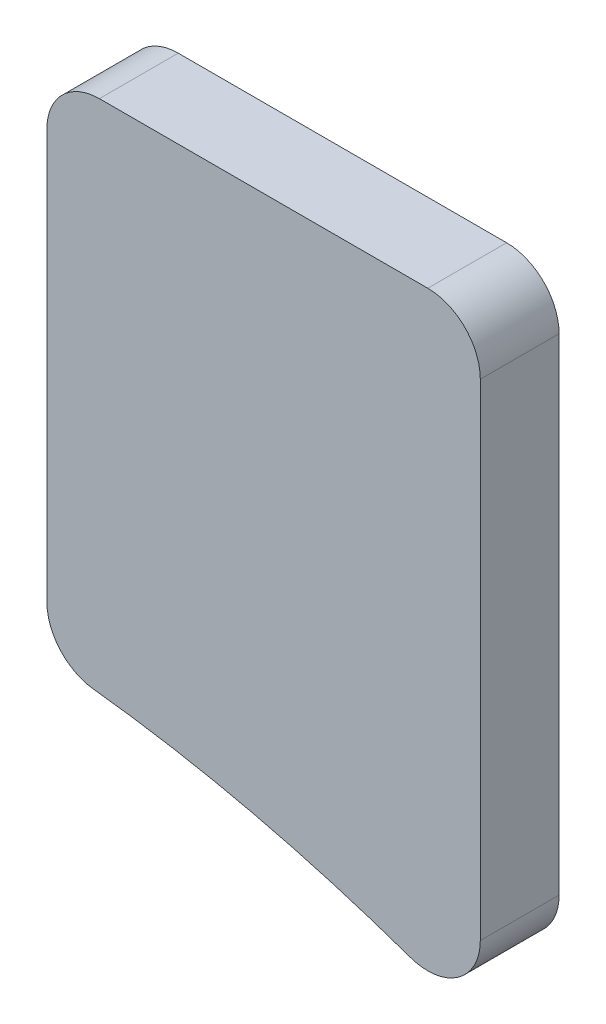
from build123d import *

# Parameters (mm, degrees)
BOSS_EXTRUDE1_DEPTH = 3
FILLET1_R           = 2


with BuildPart() as part:
    # Sketch2 → Boss-Extrude1 (new body)
    with BuildSketch(Plane.XY):
        with BuildLine():
            Line((4, 10.457560668), (4, -8.952439332))
            add(Edge.make_bspline(
                [(4, -8.952439332), (9.5, -9.387007233), (15, -10.717871431), (20.5, -12.945031924)],
                knots=[0.588888889, 0.588888889, 0.588888889, 0.588888889, 0.955555556, 0.955555556, 0.955555556, 0.955555556], degree=3))
            Line((20.5, -12.945031924), (20.5, 10.457560668))
            Line((20.5, 10.457560668), (4, 10.457560668))
        make_face()
    extrude(amount=-BOSS_EXTRUDE1_DEPTH)

    # Fillet1
    fillet1_edges = [part.edges().sort_by_distance(p)[0] for p in [
        (20.5, -12.945031924, -1.5),
        (4, -8.952439332, -1.5),
        (20.5, 10.457560668, -1.5),
        (4, 10.457560668, -1.5),
    ]]
    fillet(fillet1_edges, radius=FILLET1_R)


solid = part.part
